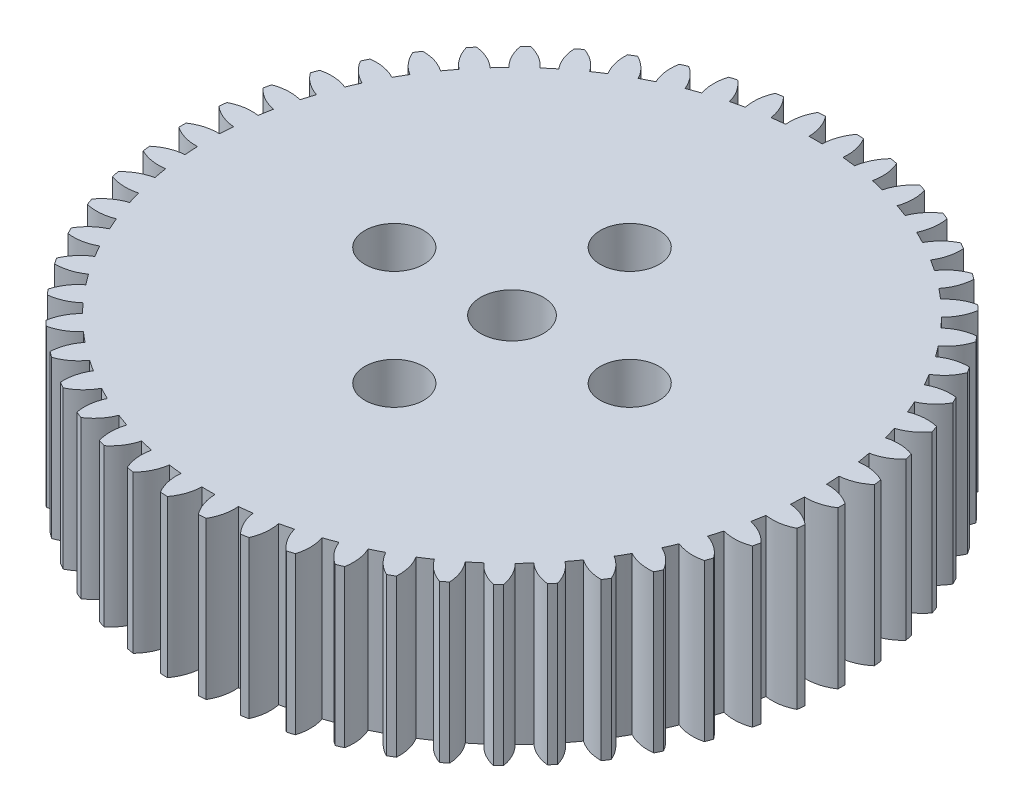
from build123d import *

# Parameters (mm, degrees)
SKIZZE1_R                       = 16.8
AUFSATZ_LINEAR_AUSTRAGEN1_DEPTH = 8
SCHNITT_LINEAR_START            = -8
SCHNITT_LINEAR_AUSTRAGEN1_DEPTH = 8
KREISMUSTER1_COUNT              = 54
SKIZZE3_R                       = 1.6
SCHNITT_LINEAR_AUSTRAGEN2_DEPTH = 8
SKIZZE4_R                       = 1.5
SCHNITT_LINEAR_AUSTRAGEN3_DEPTH = 26.056991023


with BuildPart() as part:
    # Skizze1 → Aufsatz-Linear austragen1 (new body)
    with BuildSketch(Plane(origin=(0, 0, 0), x_dir=(1, 0, 0), z_dir=(0, 1, 0))):
        with Locations(Location((0, 0, 0), (0, 0, 270))):
            Circle(SKIZZE1_R)
    extrude(amount=AUFSATZ_LINEAR_AUSTRAGEN1_DEPTH)

    # Skizze2 → Schnitt-Linear austragen1 (cut)
    with BuildSketch(Plane(origin=(0, 8, 0), x_dir=(1, 0, 0), z_dir=(0, 1, 0)).offset(SCHNITT_LINEAR_START)):
        with BuildLine():
            ThreePointArc((0.336724731, 15.476337307), (0.46108779, 16.164849804), (0.791960149, 16.781322925))
            ThreePointArc((0.791960149, 16.781322925), (0, 16.8), (-0.791960149, 16.781322925))
            ThreePointArc((-0.791960149, 16.781322925), (-0.46108779, 16.164849804), (-0.336724731, 15.476337307))
            ThreePointArc((-0.336724731, 15.476337307), (0, 15.48), (0.336724731, 15.476337307))
        make_face()
    schnitt_linear_austragen1 = extrude(amount=SCHNITT_LINEAR_AUSTRAGEN1_DEPTH, mode=Mode.SUBTRACT)

    # Kreismuster1: Schnitt-Linear austragen1 ×54 about axis
    kreismuster1_axis = Axis((0, 0, 0), (0, 1, 0))
    for i in range(1, KREISMUSTER1_COUNT):
        add(schnitt_linear_austragen1.rotate(kreismuster1_axis, i * 360 / KREISMUSTER1_COUNT), mode=Mode.SUBTRACT)

    # Skizze3 → Schnitt-Linear austragen2 (cut)
    with BuildSketch(Plane.XZ):
        with Locations(Location((0, 0, 0), (0, 0, 270))):
            Circle(SKIZZE3_R)
    extrude(amount=-SCHNITT_LINEAR_AUSTRAGEN2_DEPTH, mode=Mode.SUBTRACT)

    # Skizze4 → Schnitt-Linear austragen3 (cut, through all)
    with BuildSketch(Plane.XZ):
        with Locations(Location((0, 6, 0), (0, 0, 270))):
            Circle(SKIZZE4_R)
        with Locations(Location((6, 0, 0), (0, 0, 270))):
            Circle(SKIZZE4_R)
        with Locations(Location((0, -6, 0), (0, 0, 270))):
            Circle(SKIZZE4_R)
        with Locations(Location((-6, 0, 0), (0, 0, 270))):
            Circle(SKIZZE4_R)
    extrude(amount=-SCHNITT_LINEAR_AUSTRAGEN3_DEPTH, mode=Mode.SUBTRACT)


solid = part.part
